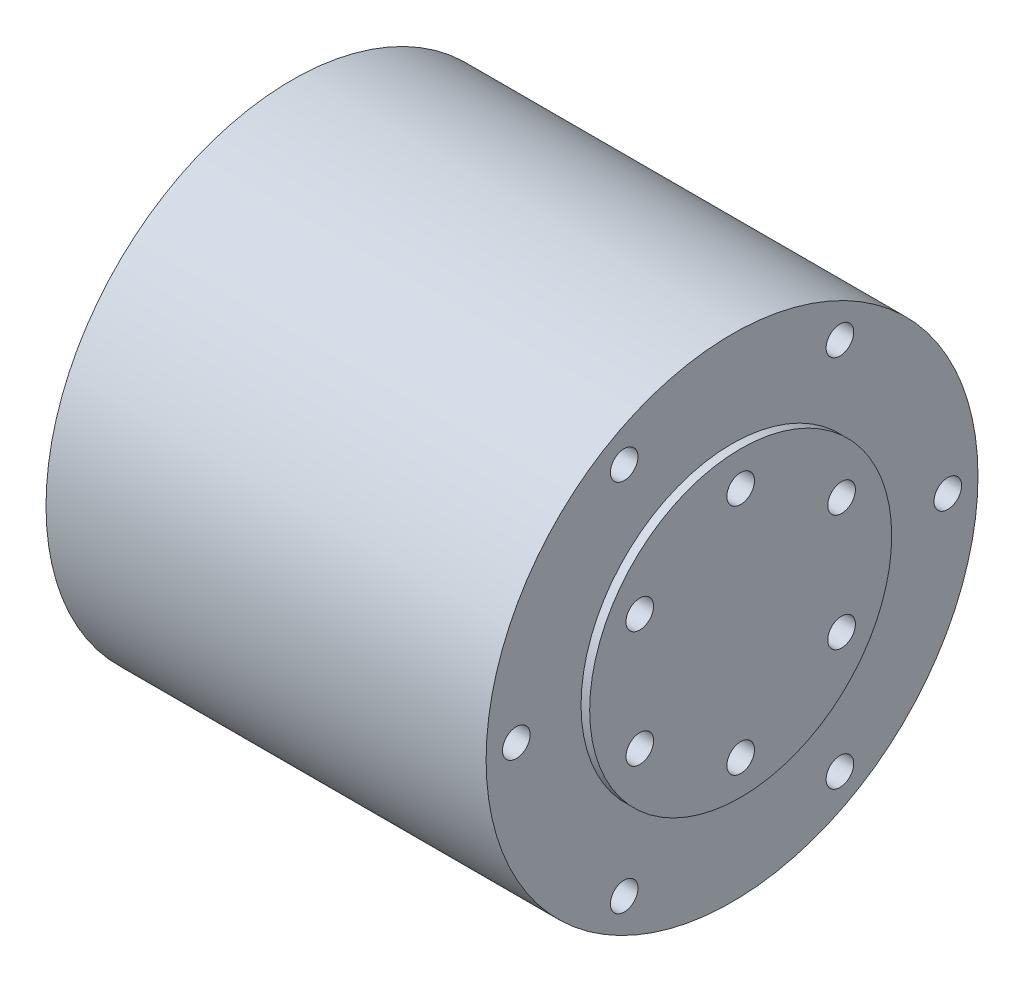
from build123d import *

# Parameters (mm, degrees)
SKETCH_1_R          = 28.5
EXTRUDE_1_DEPTH     = 51
SKETCH_2_R          = 17.5
EXTRUDE_2_DEPTH     = 1
SKETCH_3_R          = 1.6
CUT_EXTRUDE_1_DEPTH = 5
SKETCH_4_R          = 1.6
CUT_EXTRUDE_2_DEPTH = 5
SKETCH_5_R          = 1.6
CUT_EXTRUDE_3_DEPTH = 5


with BuildPart() as part:
    # 草图1 → 凸台-拉伸1 (new body)
    with BuildSketch(Plane(origin=(0, 0, 0), x_dir=(0, 0, -1), z_dir=(1, 0, 0))):
        Circle(SKETCH_1_R)
    extrude(amount=EXTRUDE_1_DEPTH)

    # 草图2 → 凸台-拉伸2 (add)
    with BuildSketch(Plane(origin=(51, 0, 0), x_dir=(0, 0, -1), z_dir=(1, 0, 0))):
        Circle(SKETCH_2_R)
    extrude(amount=EXTRUDE_2_DEPTH)

    # 草图3 → 切除-拉伸1 (cut)
    with BuildSketch(Plane.ZY):
        with Locations((13.435028843, 13.435028843)):
            Circle(SKETCH_3_R)
        with Locations((13.435028843, -13.435028843)):
            Circle(SKETCH_3_R)
        with Locations((-13.435028843, -13.435028843)):
            Circle(SKETCH_3_R)
        with Locations((-13.435028843, 13.435028843)):
            Circle(SKETCH_3_R)
    extrude(amount=-CUT_EXTRUDE_1_DEPTH, mode=Mode.SUBTRACT)

    # 草图4 → 切除-拉伸2 (cut)
    with BuildSketch(Plane(origin=(51, 0, 0), x_dir=(0, 0, -1), z_dir=(1, 0, 0))):
        with Locations((-12.5, 21.650635095)):
            Circle(SKETCH_4_R)
        with Locations((12.5, 21.650635095)):
            Circle(SKETCH_4_R)
        with Locations((25, 0)):
            Circle(SKETCH_4_R)
        with Locations((12.5, -21.650635095)):
            Circle(SKETCH_4_R)
        with Locations((-12.5, -21.650635095)):
            Circle(SKETCH_4_R)
        with Locations((-25, 0)):
            Circle(SKETCH_4_R)
    extrude(amount=-CUT_EXTRUDE_2_DEPTH, mode=Mode.SUBTRACT)

    # 草图5 → 切除-拉伸3 (cut)
    with BuildSketch(Plane(origin=(52, 0, 0), x_dir=(0, 0, -1), z_dir=(1, 0, 0))):
        with Locations((0, 13.5)):
            Circle(SKETCH_5_R)
        with Locations((11.691342951, 6.75)):
            Circle(SKETCH_5_R)
        with Locations((11.691342951, -6.75)):
            Circle(SKETCH_5_R)
        with Locations((0, -13.5)):
            Circle(SKETCH_5_R)
        with Locations((-11.691342951, -6.75)):
            Circle(SKETCH_5_R)
        with Locations((-11.691342951, 6.75)):
            Circle(SKETCH_5_R)
    extrude(amount=-CUT_EXTRUDE_3_DEPTH, mode=Mode.SUBTRACT)


solid = part.part
